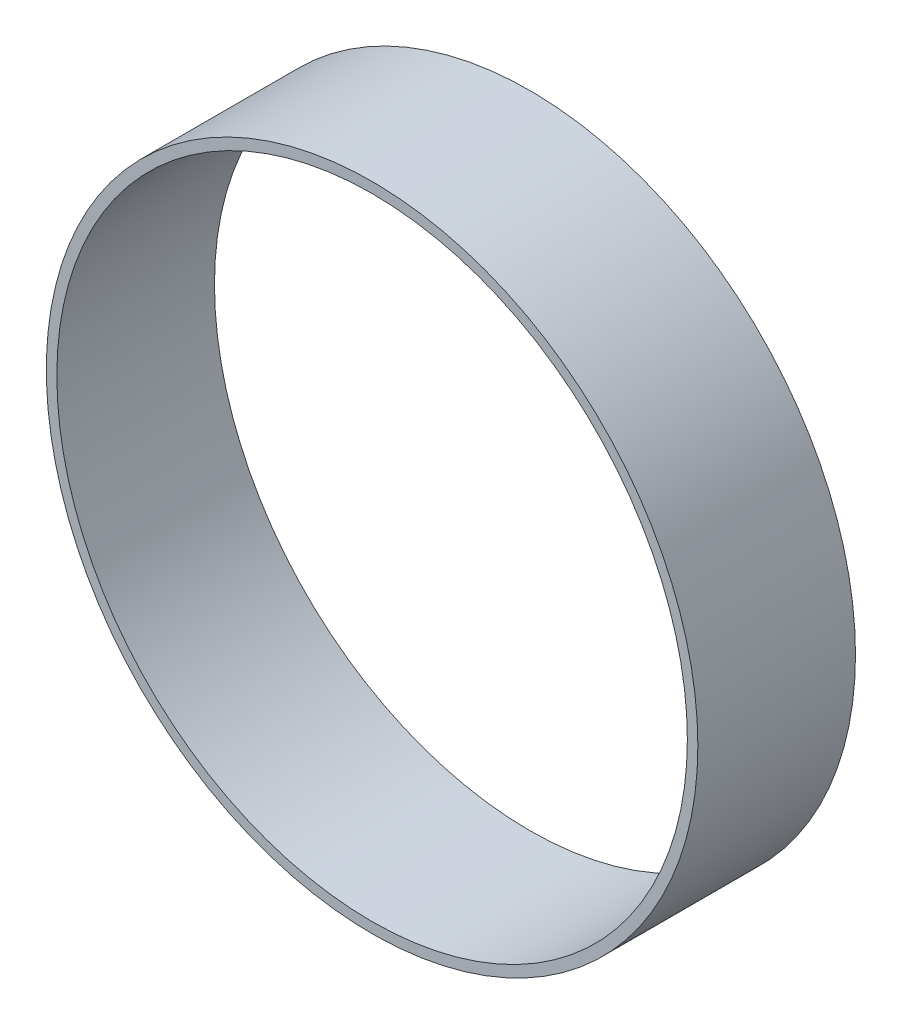
from build123d import *

# Parameters (mm, degrees)
ESBO_O1_R                = 31
ESBO_O1_R_2              = 30
RESSALTO_EXTRUS_O1_DEPTH = 15


with BuildPart() as part:
    # Esboço1 → Ressalto-extrusão1 (new body)
    with BuildSketch(Plane.XY):
        Circle(ESBO_O1_R)
        Circle(ESBO_O1_R_2, mode=Mode.SUBTRACT)
    extrude(amount=RESSALTO_EXTRUS_O1_DEPTH)


solid = part.part
